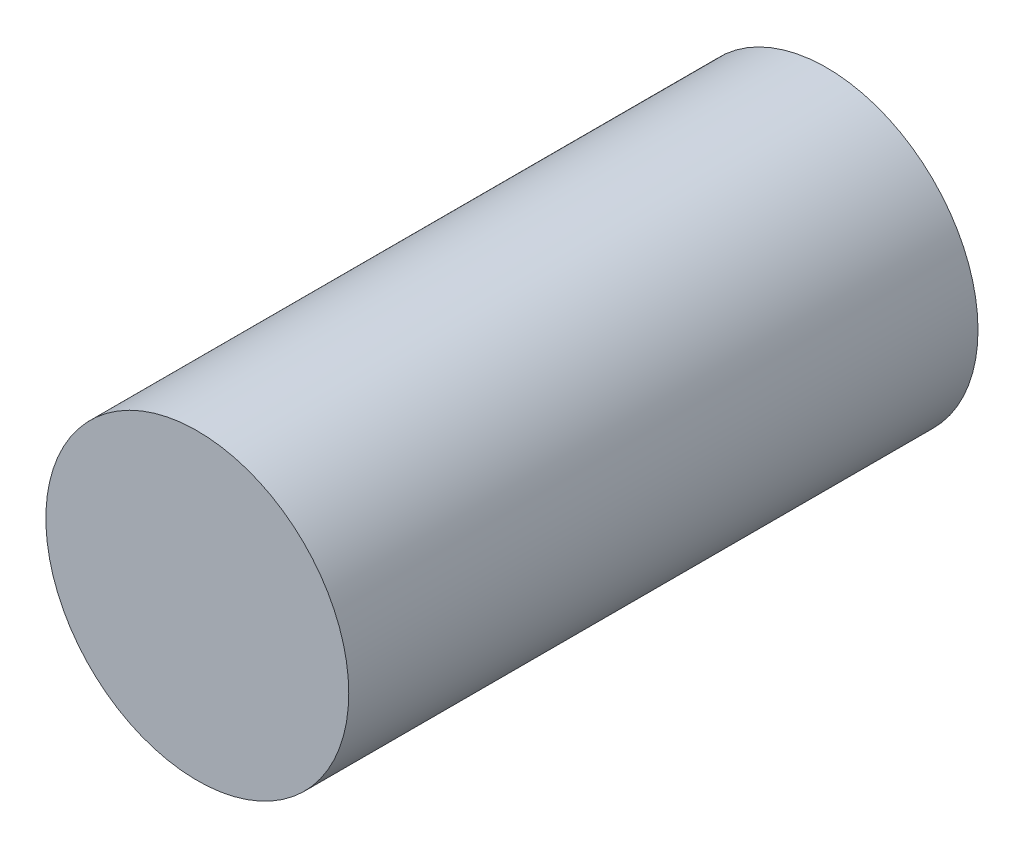
from build123d import *

# Parameters (mm, degrees)
SKETCH1_R           = 6.0175
BOSS_EXTRUDE1_DEPTH = 12.5


with BuildPart() as part:
    # Sketch1 → Boss-Extrude1 (new, symmetric)
    with BuildSketch(Plane.XY):
        Circle(SKETCH1_R)
    extrude(amount=BOSS_EXTRUDE1_DEPTH, both=True)


solid = part.part
